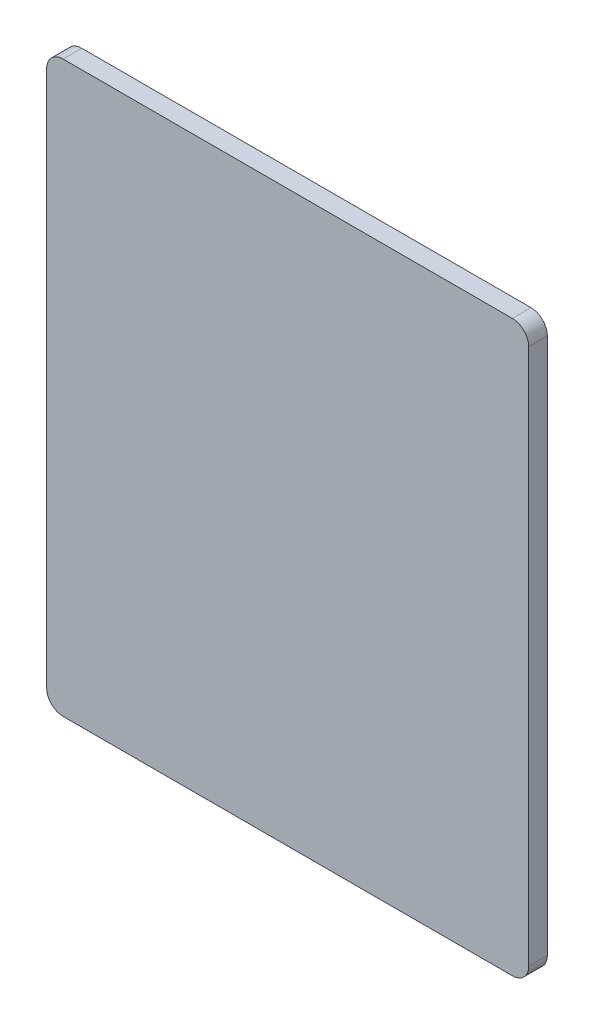
from build123d import *

# Parameters (mm, degrees)
SKETCH_1_W      = 530
SKETCH_1_H      = 626
EXTRUDE_1_DEPTH = 10.25
FILLET_1_R      = 18


with BuildPart() as part:
    # Эскиз1 → Бобышка-Вытянуть1 (new, symmetric)
    with BuildSketch(Plane.XY):
        Rectangle(SKETCH_1_W, SKETCH_1_H)
    extrude(amount=EXTRUDE_1_DEPTH, both=True)

    # Скругление1
    fillet_1_edges = [part.edges().sort_by_distance(p)[0] for p in [
        (265, -313, 0),
        (-265, -313, 0),
        (-265, 313, 0),
        (265, 313, 0),
    ]]
    fillet(fillet_1_edges, radius=FILLET_1_R)


solid = part.part
